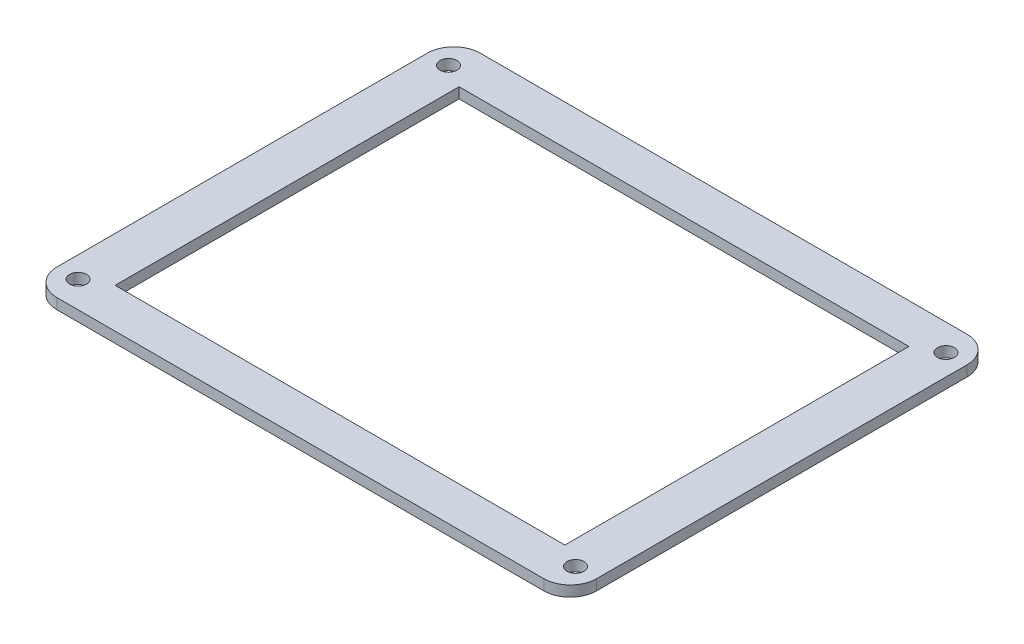
from build123d import *

# Parameters (mm, degrees)
SKETCH1_W           = 102
SKETCH1_H           = 80
SKETCH1_W_2         = 85
SKETCH1_H_2         = 65
BOSS_EXTRUDE1_DEPTH = 2
FILLET2_R           = 5
SKETCH2_R           = 1.6
CUT_EXTRUDE1_DEPTH  = 64.5


with BuildPart() as part:
    # Sketch1 → Boss-Extrude1 (new body)
    with BuildSketch(Plane(origin=(0, 0, 0), x_dir=(1, 0, 0), z_dir=(0, 1, 0))):
        Rectangle(SKETCH1_W, SKETCH1_H)
        Rectangle(SKETCH1_W_2, SKETCH1_H_2, mode=Mode.SUBTRACT)
    extrude(amount=BOSS_EXTRUDE1_DEPTH)

    # Fillet2
    fillet2_edges = [part.edges().sort_by_distance(p)[0] for p in [
        (-51, 1, 40),
        (-51, 1, -40),
        (51, 1, -40),
        (51, 1, 40),
    ]]
    fillet(fillet2_edges, radius=FILLET2_R)

    # Sketch2 → Cut-Extrude1 (cut, symmetric)
    with BuildSketch(Plane(origin=(0, 2, 0), x_dir=(1, 0, 0), z_dir=(0, 1, 0))):
        with Locations(Location((-47, -35, 0), (0, 0, 90))):
            Circle(SKETCH2_R)
        with Locations(Location((47, -35, 0), (0, 0, 90))):
            Circle(SKETCH2_R)
        with Locations(Location((47, 35, 0), (0, 0, 90))):
            Circle(SKETCH2_R)
        with Locations(Location((-47, 35, 0), (0, 0, 90))):
            Circle(SKETCH2_R)
    extrude(amount=CUT_EXTRUDE1_DEPTH, both=True, mode=Mode.SUBTRACT)


solid = part.part
